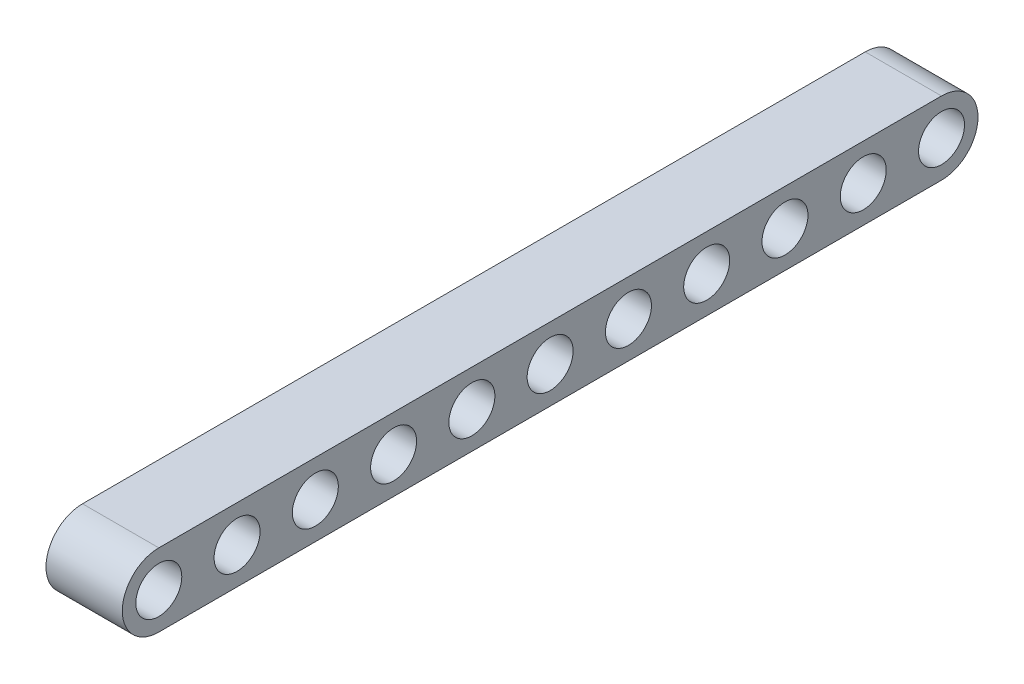
from build123d import *

# Parameters (mm, degrees)
SKETCH1_R           = 2.35
BOSS_EXTRUDE1_DEPTH = 7.8


with BuildPart() as part:
    # Sketch1 → Boss-Extrude1 (new body)
    with BuildSketch(Plane(origin=(0, 0, 0), x_dir=(0, 0, -1), z_dir=(1, 0, 0))):
        with BuildLine():
            Line((-40, -3.73), (40, -3.73))
            ThreePointArc((40, -3.73), (43.73, 0), (40, 3.73))
            Line((40, 3.73), (-40, 3.73))
            ThreePointArc((-40, 3.73), (-43.73, 0), (-40, -3.73))
        make_face()
        with Locations((-40, 0)):
            Circle(SKETCH1_R, mode=Mode.SUBTRACT)
        with Locations((-32, 0)):
            Circle(SKETCH1_R, mode=Mode.SUBTRACT)
        with Locations((-24, 0)):
            Circle(SKETCH1_R, mode=Mode.SUBTRACT)
        with Locations((-16, 0)):
            Circle(SKETCH1_R, mode=Mode.SUBTRACT)
        with Locations((-8, 0)):
            Circle(SKETCH1_R, mode=Mode.SUBTRACT)
        Circle(SKETCH1_R, mode=Mode.SUBTRACT)
        with Locations((8, 0)):
            Circle(SKETCH1_R, mode=Mode.SUBTRACT)
        with Locations((16, 0)):
            Circle(SKETCH1_R, mode=Mode.SUBTRACT)
        with Locations((24, 0)):
            Circle(SKETCH1_R, mode=Mode.SUBTRACT)
        with Locations((32, 0)):
            Circle(SKETCH1_R, mode=Mode.SUBTRACT)
        with Locations((40, 0)):
            Circle(SKETCH1_R, mode=Mode.SUBTRACT)
    extrude(amount=BOSS_EXTRUDE1_DEPTH)


solid = part.part
